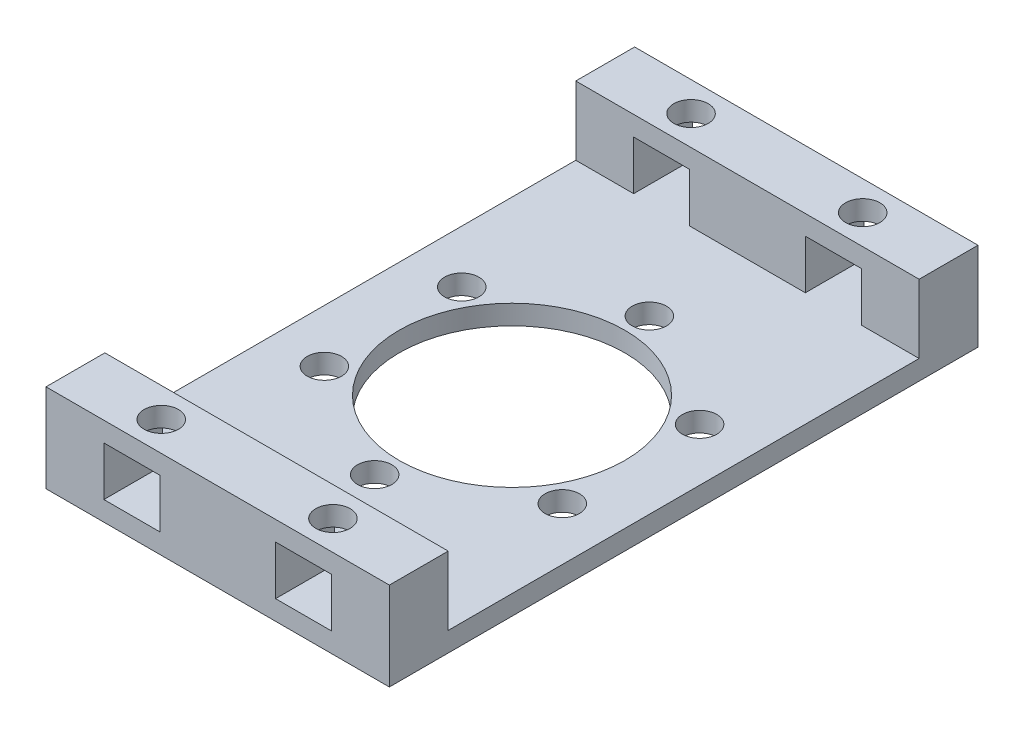
from build123d import *

# Parameters (mm, degrees)
SKETCH_1_W               = 35
SKETCH_1_H               = 60
EXTRUDE_1_DEPTH          = 2
HOLE_WIZARD_1_D          = 3.5
PATTERN_CIRCULAR_1_COUNT = 6
SKETCH_5_R               = 11.5
CUT_EXTRUDE_1_DEPTH      = 2
SKETCH_11_W              = 35
SKETCH_11_H              = 6
EXTRUDE_2_DEPTH          = 7
SKETCH_12_W              = 2.85
SKETCH_12_H              = 5
CUT_EXTRUDE_3_DEPTH      = 64.144675152
HOLE_WIZARD_2_D          = 3.5
HOLE_WIZARD_2_DEPTH      = 2


with BuildPart() as part:
    # 草图1 → 凸台-拉伸1 (new body)
    with BuildSketch(Plane(origin=(0, 0, 0), x_dir=(1, 0, 0), z_dir=(0, 1, 0))):
        Rectangle(SKETCH_1_W, SKETCH_1_H)
    extrude(amount=EXTRUDE_1_DEPTH)

    # 孔1 (through all)
    with Locations(Plane(origin=(0, 2, 0), x_dir=(1, 0, 0), z_dir=(0, 1, 0))):
        with Locations((0, 14)):
            hole_wizard_1 = Hole(HOLE_WIZARD_1_D / 2)

    # 阵列(圆周)1: 孔1 ×6 about axis
    pattern_circular_1_axis = Axis((0, 0, 0), (0, 1, 0))
    for i in range(1, PATTERN_CIRCULAR_1_COUNT):
        add(hole_wizard_1.rotate(pattern_circular_1_axis, i * 360 / PATTERN_CIRCULAR_1_COUNT), mode=Mode.SUBTRACT)

    # 草图5 → 切除-拉伸1 (cut)
    with BuildSketch(Plane(origin=(0, 2, 0), x_dir=(1, 0, 0), z_dir=(0, 1, 0))):
        with Locations(Location((0, 0, 0), (0, 0, 270))):
            Circle(SKETCH_5_R)
    extrude(amount=-CUT_EXTRUDE_1_DEPTH, mode=Mode.SUBTRACT)

    # 草图11 → 凸台-拉伸2 (add)
    with BuildSketch(Plane(origin=(0, 2, 0), x_dir=(1, 0, 0), z_dir=(0, 1, 0))):
        with Locations((0, -27)):
            Rectangle(SKETCH_11_W, SKETCH_11_H)
        with Locations((0, 27)):
            Rectangle(SKETCH_11_W, SKETCH_11_H)
    extrude(amount=EXTRUDE_2_DEPTH)

    # 草图12 → 切除-拉伸3 (cut, through all)
    with BuildSketch(Plane.XY.offset(30)):
        with Locations((-10.175, 4.5)):
            Rectangle(SKETCH_12_W, SKETCH_12_H)
        with Locations((-7.325, 4.5)):
            Rectangle(SKETCH_12_W, SKETCH_12_H)
        with Locations((10.175, 4.5)):
            Rectangle(SKETCH_12_W, SKETCH_12_H)
        with Locations((7.325, 4.5)):
            Rectangle(SKETCH_12_W, SKETCH_12_H)
    extrude(amount=-CUT_EXTRUDE_3_DEPTH, mode=Mode.SUBTRACT)

    # 孔2
    with Locations(Plane(origin=(0, 9, 0), x_dir=(1, 0, 0), z_dir=(0, 1, 0))):
        with Locations((-8.75, 27), (8.75, 27), (-8.75, -27), (8.75, -27)):
            Hole(HOLE_WIZARD_2_D / 2, depth=HOLE_WIZARD_2_DEPTH)


solid = part.part
